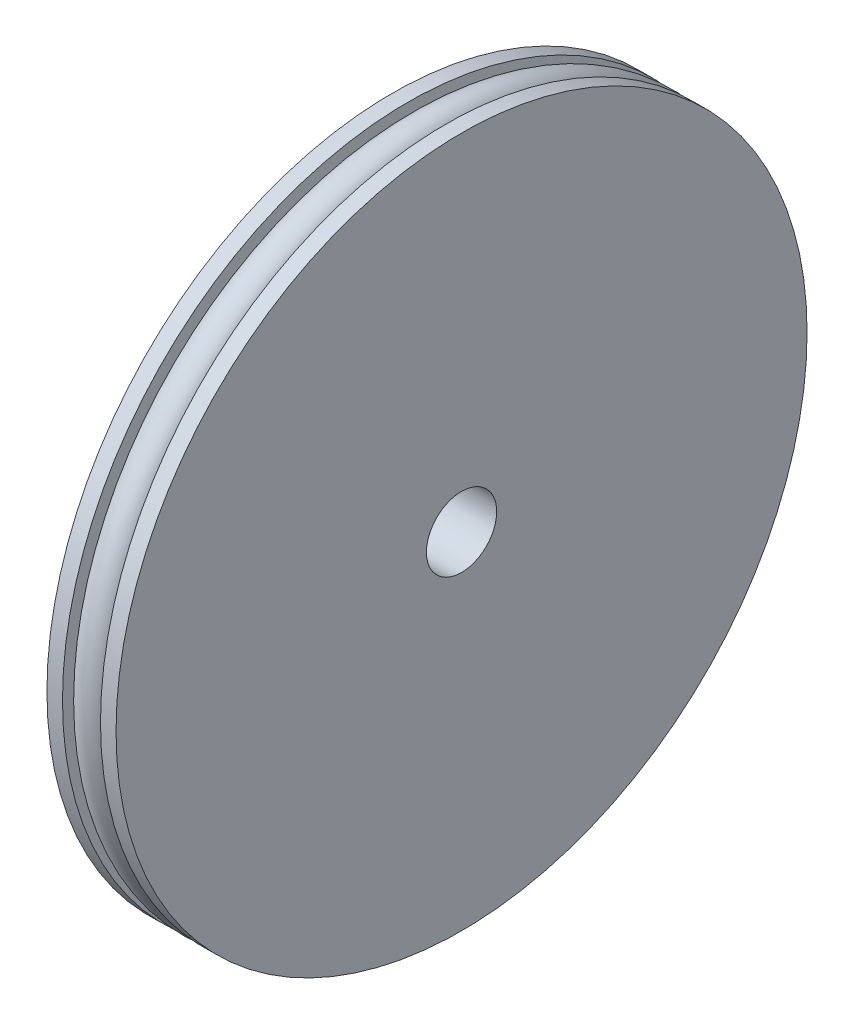
from build123d import *

# Parameters (mm, degrees)
ESQUISSE3_R             = 7.522774239
BOSS_EXTRU_1_DEPTH      = 8
ESQUISSE4_R             = 3.05
ENL_V_MAT_EXTRU_1_DEPTH = 45.676615942


with BuildPart() as part:
    # Esquisse1 → Révolution1 (revolve)
    with BuildSketch(Plane.XY, mode=Mode.PRIVATE) as r_volution1_sk:
        Polygon((1.35, 30), (1.35, 25), (4.65, 25), (4.65, 30), (6, 30), (6, 0), (0, 0), (0, 30), align=None)
    revolve(r_volution1_sk.sketch.rotate(Axis((0, 0, 0), (1, 0, 0)), 90), axis=Axis((0, 0, 0), (1, 0, 0)))

    # Esquisse3 → Boss.-Extru.1 (add)
    with BuildSketch(Plane.ZY):
        with Locations(Location((0, 0, 0), (0, 0, 180))):
            Circle(ESQUISSE3_R)
    extrude(amount=BOSS_EXTRU_1_DEPTH)

    # Esquisse4 → Enlèv. mat.-Extru.1 (cut, through all)
    with BuildSketch(Plane.ZY.offset(8)):
        Circle(ESQUISSE4_R)
    extrude(amount=-ENL_V_MAT_EXTRU_1_DEPTH, mode=Mode.SUBTRACT)


with BuildPart() as body_2:
    # Esquisse2 → Révolution2 (revolve)
    with BuildSketch(Plane.XY, mode=Mode.PRIVATE) as r_volution2_sk:
        with BuildLine():
            Line((4.65, 25), (1.35, 25))
            Line((1.35, 25), (1.35, 28.35))
            ThreePointArc((1.35, 28.35), (3, 30), (4.65, 28.35))
            Line((4.65, 28.35), (4.65, 25))
        make_face()
    revolve(r_volution2_sk.sketch.rotate(Axis((-10.330885644, 0, 0), (1, 0, 0)), 90), axis=Axis((-10.330885644, 0, 0), (1, 0, 0)))


solid = Compound([part.part, body_2.part])
